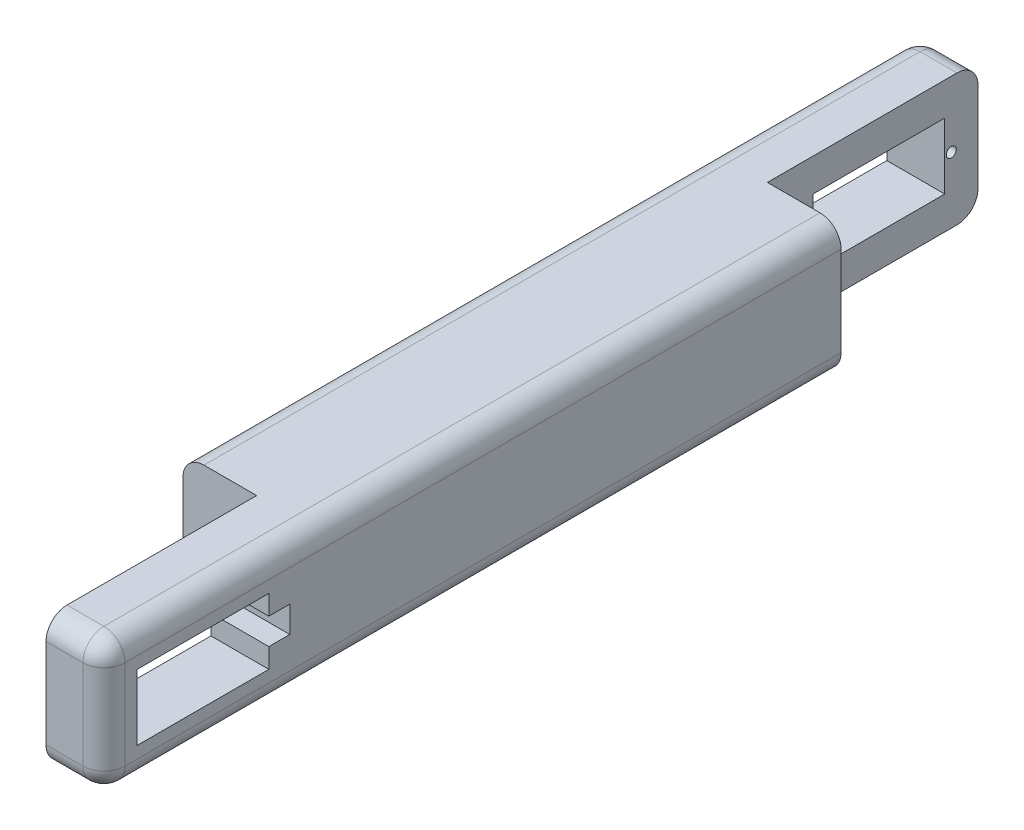
from build123d import *

# Parameters (mm, degrees)
SKETCH3_W           = 25
SKETCH3_H           = 180
BOSS_EXTRUDE1_DEPTH = 25
SKETCH4_W           = 14
SKETCH4_H           = 40
CUT_EXTRUDE1_DEPTH  = 183.157212319
SKETCH6_W           = 25
SKETCH6_H           = 12.5
CUT_EXTRUDE2_DEPTH  = 183.26628871
SKETCH6_3_R         = 0.95
CUT_EXTRUDE3_DEPTH  = 9
SKETCH8_W           = 25
SKETCH8_H           = 12.5
CUT_EXTRUDE4_DEPTH  = 183.26628871
SKETCH8_3_R         = 0.95
CUT_EXTRUDE5_DEPTH  = 9
FILLET1_R           = 4
CUT_EXTRUDE6_START  = -2
SKETCH12_W          = 3.466571871
SKETCH12_H          = 5
CUT_EXTRUDE6_DEPTH  = 10
CUT_EXTRUDE7_START  = -2
SKETCH11_W          = 3.979632528
SKETCH11_H          = 5
CUT_EXTRUDE7_DEPTH  = 14
FILLET2_R           = 4
FILLET3_R           = 4


with BuildPart() as part:
    # Sketch3 → Boss-Extrude1 (new body)
    with BuildSketch(Plane(origin=(0, 0, 0), x_dir=(1, 0, 0), z_dir=(0, 1, 0))):
        with Locations((0, 90)):
            Rectangle(SKETCH3_W, SKETCH3_H)
    extrude(amount=BOSS_EXTRUDE1_DEPTH)

    # Sketch4 → Cut-Extrude1 (cut, through all)
    with BuildSketch(Plane(origin=(0, 25, 0), x_dir=(1, 0, 0), z_dir=(0, 1, 0))):
        with Locations((-5.5, 20)):
            Rectangle(SKETCH4_W, SKETCH4_H)
        with Locations((5.5, 160)):
            Rectangle(SKETCH4_W, SKETCH4_H)
    extrude(amount=-CUT_EXTRUDE1_DEPTH, mode=Mode.SUBTRACT)

    # Sketch6 → Cut-Extrude2 (cut, through all)
    with BuildSketch(Plane.ZY.offset(-1.5)):
        with Locations((-18.82, 12.5)):
            Rectangle(SKETCH6_W, SKETCH6_H)
    extrude(amount=-CUT_EXTRUDE2_DEPTH, mode=Mode.SUBTRACT)

    # Sketch6<3> → Cut-Extrude3 (cut)
    with BuildSketch(Plane.ZY.offset(-1.5)):
        with Locations((-32.57, 12.5)):
            Circle(SKETCH6_3_R)
        with Locations((-5.07, 12.5)):
            Circle(SKETCH6_3_R)
    extrude(amount=-CUT_EXTRUDE3_DEPTH, mode=Mode.SUBTRACT)

    # Sketch8 → Cut-Extrude4 (cut, through all)
    with BuildSketch(Plane(origin=(-1.5, 0, 0), x_dir=(0, 0, -1), z_dir=(1, 0, 0))):
        with Locations((161.18, 12.5)):
            Rectangle(SKETCH8_W, SKETCH8_H)
    extrude(amount=-CUT_EXTRUDE4_DEPTH, mode=Mode.SUBTRACT)

    # Sketch8<3> → Cut-Extrude5 (cut)
    with BuildSketch(Plane(origin=(-1.5, 0, 0), x_dir=(0, 0, -1), z_dir=(1, 0, 0))):
        with Locations((147.43, 12.5)):
            Circle(SKETCH8_3_R)
        with Locations((174.93, 12.5)):
            Circle(SKETCH8_3_R)
    extrude(amount=-CUT_EXTRUDE5_DEPTH, mode=Mode.SUBTRACT)

    # Fillet1
    fillet1_edges = [part.edges().sort_by_distance(p)[0] for p in [
        (-12.5, 0, -110),
        (-12.5, 25, -110),
        (12.5, 0, -70),
        (12.5, 25, -70),
    ]]
    fillet(fillet1_edges, radius=FILLET1_R)

    # Sketch12 → Cut-Extrude6 (cut)
    with BuildSketch(Plane(origin=(-1.5, 0, 0), x_dir=(0, 0, -1), z_dir=(1, 0, 0)).offset(CUT_EXTRUDE6_START)):
        with Locations((146.946714065, 12.5)):
            Rectangle(SKETCH12_W, SKETCH12_H)
    extrude(amount=-CUT_EXTRUDE6_DEPTH, mode=Mode.SUBTRACT)

    # Sketch11 → Cut-Extrude7 (cut)
    with BuildSketch(Plane.ZY.offset(-1.5).offset(CUT_EXTRUDE7_START)):
        with Locations((-33.309816264, 12.5)):
            Rectangle(SKETCH11_W, SKETCH11_H)
    extrude(amount=-CUT_EXTRUDE7_DEPTH, mode=Mode.SUBTRACT)

    # Fillet2
    fillet2_edges = [part.edges().sort_by_distance(p)[0] for p in [
        (-5, 25, -180),
        (-11.328427125, 23.828427125, -180),
        (-5, 0, -180),
        (-11.328427125, 1.171572875, -180),
        (-12.5, 12.5, -180),
    ]]
    fillet(fillet2_edges, radius=FILLET2_R)

    # Fillet3
    fillet3_edges = [part.edges().sort_by_distance(p)[0] for p in [
        (5, 25, 0),
        (11.328427125, 23.828427125, 0),
        (5, 0, 0),
        (11.328427125, 1.171572875, 0),
        (12.5, 12.5, 0),
    ]]
    fillet(fillet3_edges, radius=FILLET3_R)


solid = part.part
